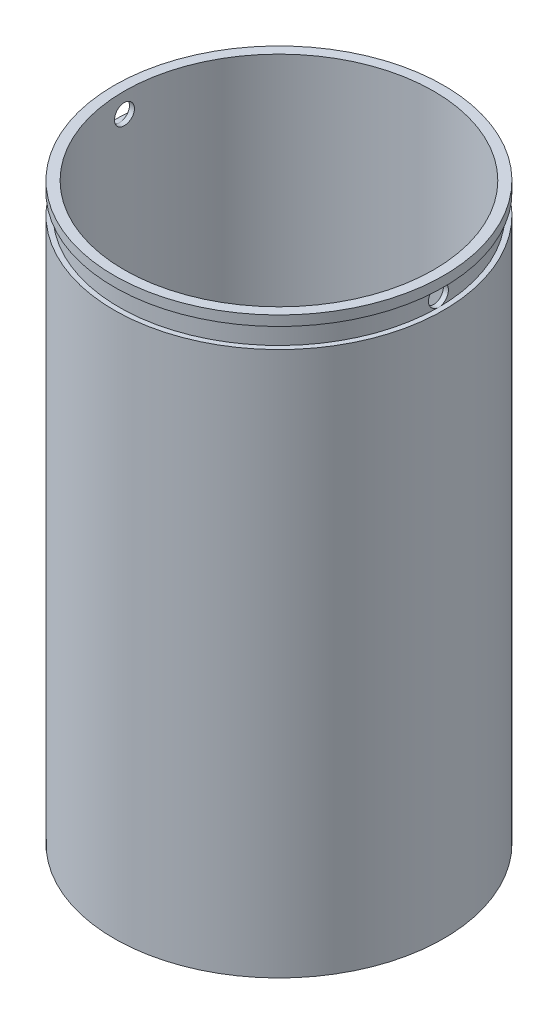
from build123d import *

# Parameters (mm, degrees)
ESQUISSE3_R             = 31
ENL_V_MAT_EXTRU_2_DEPTH = 113
ESQUISSE4_R             = 2
ENL_V_MAT_EXTRU_3_DEPTH = 64
ESQUISSE6_R             = 3.5
ENL_V_MAT_EXTRU_5_DEPTH = 10


with BuildPart() as part:
    # Esquisse1 → Révolution1 (revolve)
    with BuildSketch(Plane.XY):
        Polygon((0, 0), (0, 109), (1, 109), (1, 113), (0, 113), (0, 115), (33, 115), (33, 0), align=None)
    revolve(axis=Axis((33, 183.335721317, 0), (0, -1, 0)))

    # Esquisse3 → Enlèv. mat.-Extru.2 (cut)
    with BuildSketch(Plane(origin=(0, 115, 0), x_dir=(1, 0, 0), z_dir=(0, 1, 0))):
        with Locations(Location((33, 0, 0), (0, 0, 180))):
            Circle(ESQUISSE3_R)
    extrude(amount=-ENL_V_MAT_EXTRU_2_DEPTH, mode=Mode.SUBTRACT)

    # Esquisse4 → Enlèv. mat.-Extru.3 (cut)
    with BuildSketch(Plane(origin=(65, 0, 0), x_dir=(0, 0, -1), z_dir=(1, 0, 0))):
        with Locations(Location((0, 111, 0), (0, 0, 90))):
            Circle(ESQUISSE4_R)
    extrude(amount=-ENL_V_MAT_EXTRU_3_DEPTH, mode=Mode.SUBTRACT)

    # Esquisse6 → Enlèv. mat.-Extru.5 (cut)
    with BuildSketch(Plane.XZ):
        with Locations((54.297953152, 14.912987345)):
            Circle(ESQUISSE6_R)
        with Locations((18.087012655, 21.297953152)):
            Circle(ESQUISSE6_R)
        with Locations(Location((11.702046848, -14.912987345, 0), (0, 0, 180))):
            Circle(ESQUISSE6_R)
        with Locations(Location((47.912987345, -21.297953152, 0), (0, 0, 180))):
            Circle(ESQUISSE6_R)
    extrude(amount=-ENL_V_MAT_EXTRU_5_DEPTH, mode=Mode.SUBTRACT)


solid = part.part
